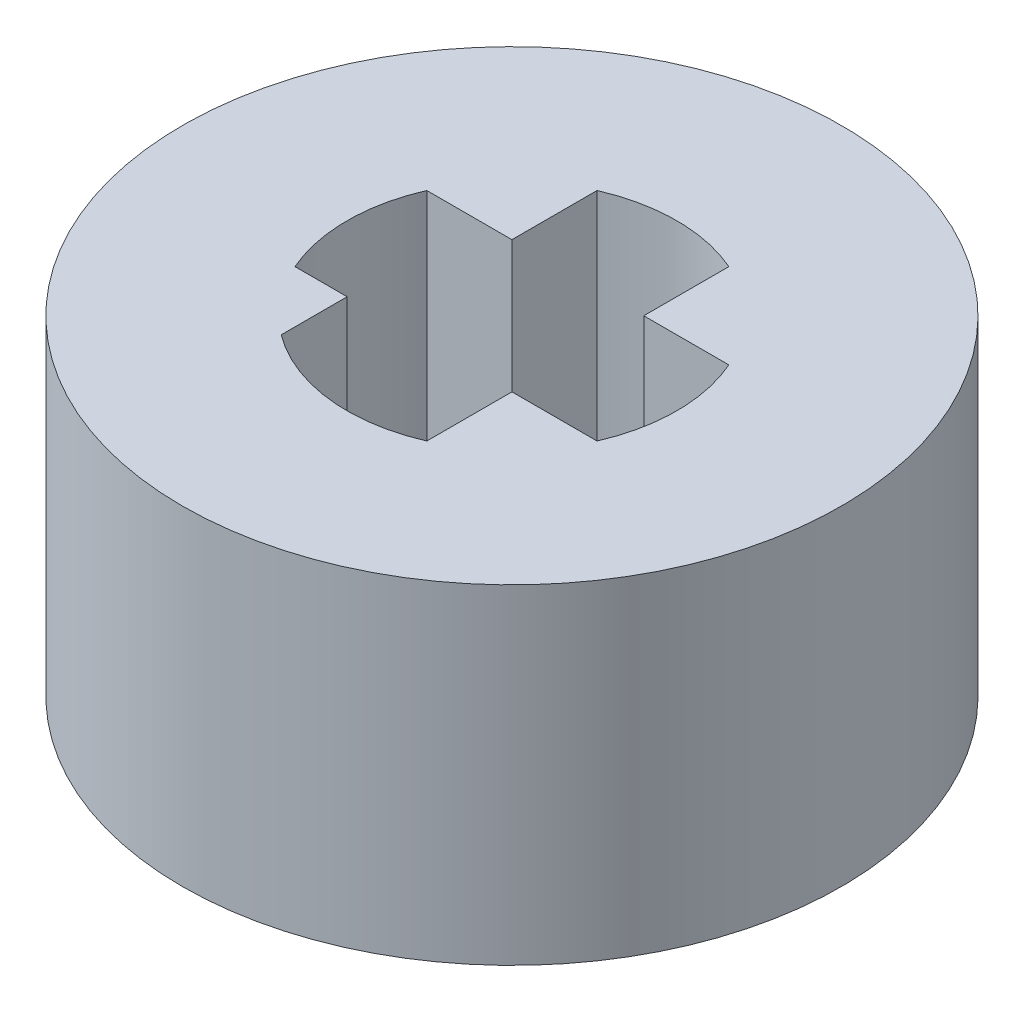
from build123d import *

# Parameters (mm, degrees)
SKETCH1_R           = 5
BOSS_EXTRUDE1_DEPTH = 5


with BuildPart() as part:
    # Sketch1 → Boss-Extrude1 (new body)
    with BuildSketch(Plane(origin=(0, 0, 0), x_dir=(1, 0, 0), z_dir=(0, 1, 0))):
        with Locations(Location((0, 0, 0), (0, 0, 270))):
            Circle(SKETCH1_R)
        with BuildLine():
            Line((1, -1), (1, -2.291287847))
            ThreePointArc((1, -2.291287847), (-0.289330525, -2.483201129), (-1.5, -2))
            Line((-1.5, -2), (-1.5, -1))
            Line((-1.5, -1), (-2.291287847, -1))
            ThreePointArc((-2.291287847, -1), (-2.5, 0), (-2.291287847, 1))
            Line((-2.291287847, 1), (-1, 1))
            Line((-1, 1), (-1, 2.291287847))
            ThreePointArc((-1, 2.291287847), (0, 2.5), (1, 2.291287847))
            Line((1, 2.291287847), (1, 1))
            Line((1, 1), (2.291287847, 1))
            ThreePointArc((2.291287847, 1), (2.5, 0), (2.291287847, -1))
            Line((2.291287847, -1), (1, -1))
        make_face(mode=Mode.SUBTRACT)
    extrude(amount=BOSS_EXTRUDE1_DEPTH)


solid = part.part
